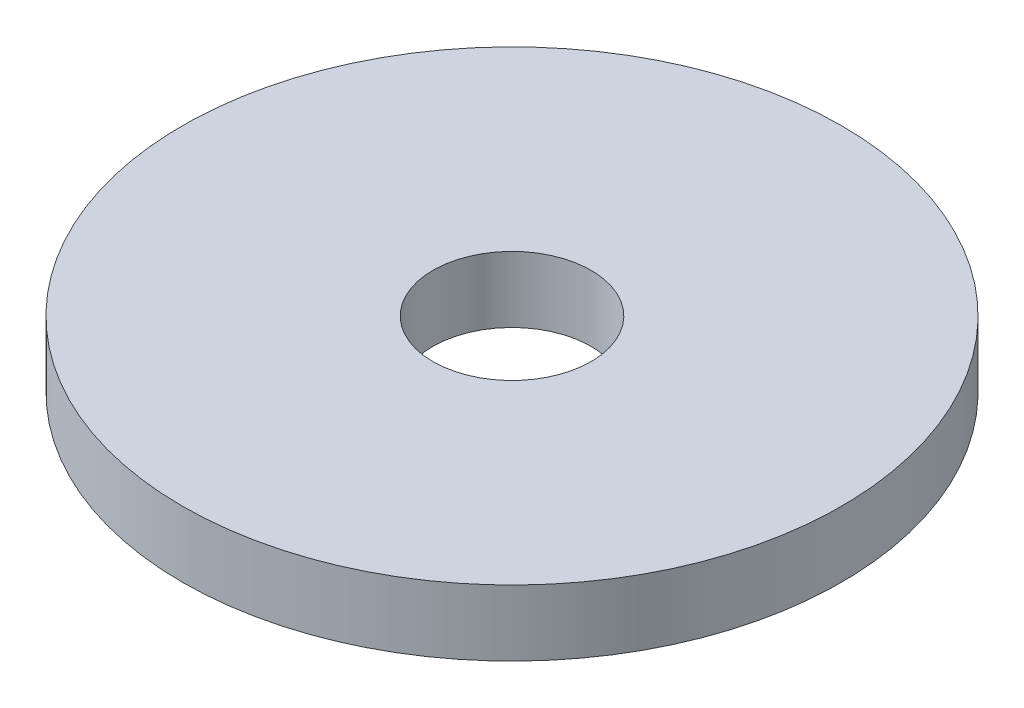
from build123d import *

# Parameters (mm, degrees)
SKETCH_1_R      = 25
SKETCH_1_R_2    = 6
EXTRUDE_1_DEPTH = 5


with BuildPart() as part:
    # Эскиз1 → Бобышка-Вытянуть1 (new body)
    with BuildSketch(Plane(origin=(0, 0, 0), x_dir=(1, 0, 0), z_dir=(0, 1, 0))):
        with Locations(Location((0, 0, 0), (0, 0, 270))):
            Circle(SKETCH_1_R)
        with Locations(Location((0, 0, 0), (0, 0, 270))):
            Circle(SKETCH_1_R_2, mode=Mode.SUBTRACT)
    extrude(amount=EXTRUDE_1_DEPTH)


solid = part.part
